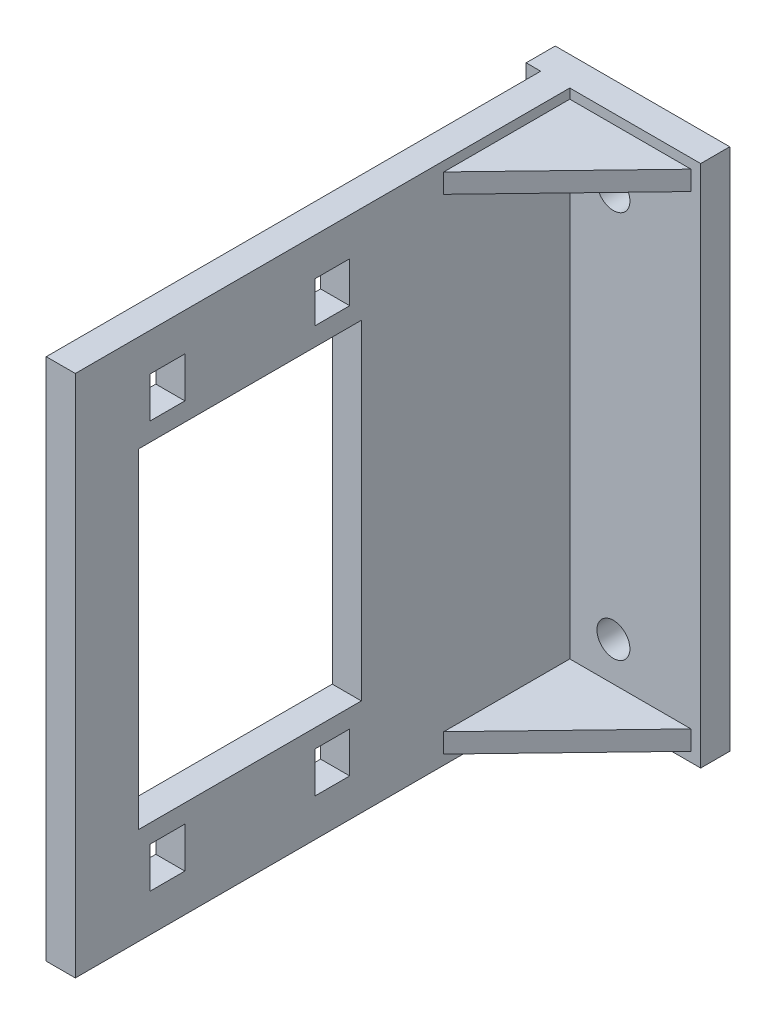
from build123d import *

# Parameters (mm, degrees)
SKETCH_1_W                         = 18
SKETCH_1_H                         = 54
FOOT_DEPTH                         = 3
UPRIGHT_START                      = 3
SKETCH_2_W                         = 3
SKETCH_2_H                         = 54
UPRIGHT_DEPTH                      = 51
REAR_COMPONENTS_OPEN_WINDOW_START  = -8
SKETCH_3_W                         = 23
SKETCH_3_H                         = 34
REAR_COMPONENTS_OPEN_WINDOW_DEPTH  = 5
SENSOR_M2_SLOTS_CENTRES42X17_START = -8
SKETCH_4_W                         = 3.6
SKETCH_4_H                         = 4.2
SENSOR_M2_SLOTS_CENTRES42X17_DEPTH = 5
SIDE_GUSSET_START                  = -26
SIDE_GUSSET_DEPTH                  = 2
EXTRUDE_START                      = 24
EXTRUDE_4_DEPTH                    = 2
FOOT_M3_HOLES_PITCH40_START        = -0.1
SKETCH_7_R                         = 1.7
FOOT_M3_HOLES_PITCH40_DEPTH        = 3.2


with BuildPart() as part:
    # 草图1 → Foot (new body)
    with BuildSketch(Plane.XY):
        Rectangle(SKETCH_1_W, SKETCH_1_H)
    extrude(amount=FOOT_DEPTH)

    # 草图2 → Upright (add)
    with BuildSketch(Plane.XY.offset(UPRIGHT_START)):
        with Locations((-6, 0)):
            Rectangle(SKETCH_2_W, SKETCH_2_H)
    extrude(amount=UPRIGHT_DEPTH)

    # 草图3 → Rear_components_open_window (cut)
    with BuildSketch(Plane(origin=(0, 0, 0), x_dir=(0, 0, -1), z_dir=(1, 0, 0)).offset(REAR_COMPONENTS_OPEN_WINDOW_START)):
        with Locations((-36, 0)):
            Rectangle(SKETCH_3_W, SKETCH_3_H)
    extrude(amount=REAR_COMPONENTS_OPEN_WINDOW_DEPTH, mode=Mode.SUBTRACT)

    # 草图4 → Sensor_M2_slots_centres42x17 (cut)
    with BuildSketch(Plane(origin=(0, 0, 0), x_dir=(0, 0, -1), z_dir=(1, 0, 0)).offset(SENSOR_M2_SLOTS_CENTRES42X17_START)):
        with Locations((-27.5, -21)):
            Rectangle(SKETCH_4_W, SKETCH_4_H)
        with Locations((-44.5, -21)):
            Rectangle(SKETCH_4_W, SKETCH_4_H)
        with Locations((-27.5, 21)):
            Rectangle(SKETCH_4_W, SKETCH_4_H)
        with Locations((-44.5, 21)):
            Rectangle(SKETCH_4_W, SKETCH_4_H)
    extrude(amount=SENSOR_M2_SLOTS_CENTRES42X17_DEPTH, mode=Mode.SUBTRACT)

    # 草图5 → Side_gusset (add)
    with BuildSketch(Plane(origin=(0, 0, 0), x_dir=(1, 0, 0), z_dir=(0, 1, 0)).offset(SIDE_GUSSET_START)):
        Polygon((-4.5, -3), (8, -3), (-4.5, -16), align=None)
    extrude(amount=SIDE_GUSSET_DEPTH)

    # 草图6 → 凸台-拉伸4 (add)
    with BuildSketch(Plane(origin=(0, 0, 0), x_dir=(1, 0, 0), z_dir=(0, 1, 0)).offset(EXTRUDE_START)):
        Polygon((-4.5, -3), (8, -3), (-4.5, -16), align=None)
    extrude(amount=EXTRUDE_4_DEPTH)

    # 草图7 → Foot_M3_holes_pitch40 (cut)
    with BuildSketch(Plane.XY.offset(FOOT_M3_HOLES_PITCH40_START)):
        with Locations((0, -20)):
            Circle(SKETCH_7_R)
        with Locations((0, 20)):
            Circle(SKETCH_7_R)
    extrude(amount=FOOT_M3_HOLES_PITCH40_DEPTH, mode=Mode.SUBTRACT)


solid = part.part
